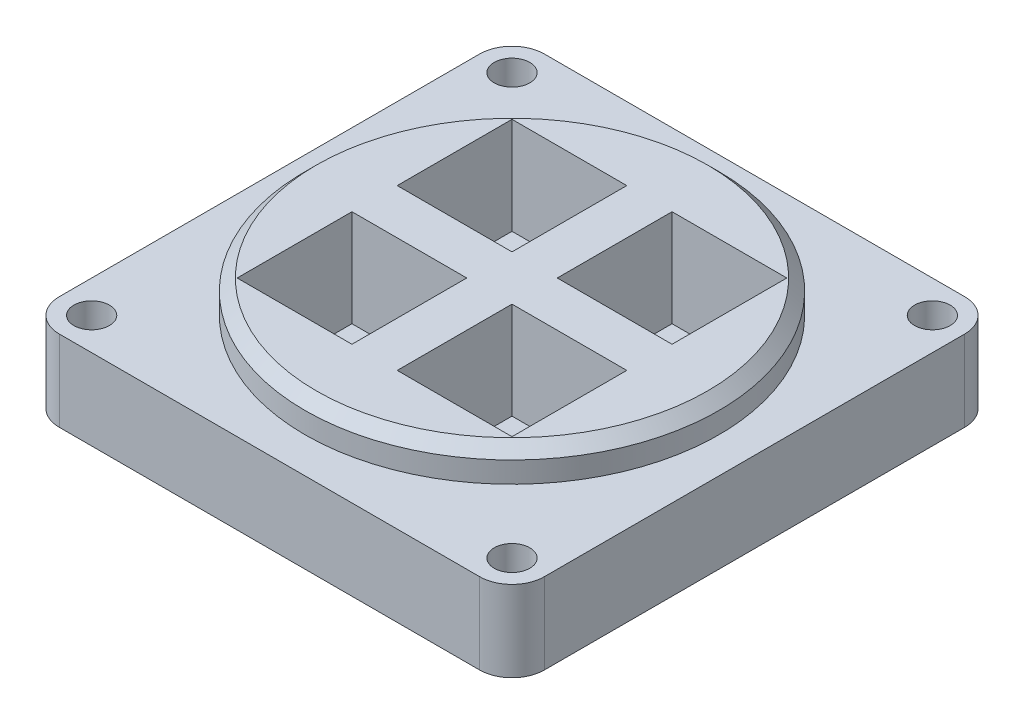
from build123d import *

# Parameters (mm, degrees)
SKETCH1_W           = 76.2
SKETCH1_H           = 76.2
BOSS_EXTRUDE1_DEPTH = 12.7
SKETCH2_R           = 2.794
CUT_EXTRUDE1_DEPTH  = 56.358016583
SKETCH2_3_R         = 32.512
BOSS_EXTRUDE2_DEPTH = 5.08
SKETCH5_W           = 18.034
SKETCH5_H           = 18.034
CUT_EXTRUDE2_DEPTH  = 15.24
FILLET1_R           = 5.08
CHAMFER1_SIZE       = 1.778


with BuildPart() as part:
    # Sketch1 → Boss-Extrude1 (new body)
    with BuildSketch(Plane(origin=(0, 0, 0), x_dir=(1, 0, 0), z_dir=(0, 1, 0))):
        Rectangle(SKETCH1_W, SKETCH1_H)
    extrude(amount=BOSS_EXTRUDE1_DEPTH)

    # Sketch2 → Cut-Extrude1 (cut, through all)
    with BuildSketch(Plane(origin=(0, 12.7, 0), x_dir=(1, 0, 0), z_dir=(0, 1, 0))):
        with Locations((33.02, 33.02)):
            Circle(SKETCH2_R)
        with Locations((33.02, -33.02)):
            Circle(SKETCH2_R)
        with Locations((-33.02, -33.02)):
            Circle(SKETCH2_R)
        with Locations((-33.02, 33.02)):
            Circle(SKETCH2_R)
    extrude(amount=-CUT_EXTRUDE1_DEPTH, mode=Mode.SUBTRACT)

    # Sketch2<3> → Boss-Extrude2 (add)
    with BuildSketch(Plane(origin=(0, 12.7, 0), x_dir=(1, 0, 0), z_dir=(0, 1, 0))):
        Circle(SKETCH2_3_R)
    extrude(amount=BOSS_EXTRUDE2_DEPTH)

    # Sketch5 → Cut-Extrude2 (cut)
    with BuildSketch(Plane(origin=(0, 17.78, 0), x_dir=(1, 0, 0), z_dir=(0, 1, 0))):
        with Locations((-12.572358569, 12.572358569)):
            Rectangle(SKETCH5_W, SKETCH5_H)
        with Locations((12.572358569, 12.572358569)):
            Rectangle(SKETCH5_W, SKETCH5_H)
        with Locations((12.572358569, -12.572358569)):
            Rectangle(SKETCH5_W, SKETCH5_H)
        with Locations((-12.572358569, -12.572358569)):
            Rectangle(SKETCH5_W, SKETCH5_H)
    extrude(amount=-CUT_EXTRUDE2_DEPTH, mode=Mode.SUBTRACT)

    # Fillet1
    fillet1_edges = [part.edges().sort_by_distance(p)[0] for p in [
        (-38.1, 6.35, 38.1),
        (38.1, 6.35, 38.1),
        (38.1, 6.35, -38.1),
        (-38.1, 6.35, -38.1),
    ]]
    fillet(fillet1_edges, radius=FILLET1_R)

    # Chamfer1
    chamfer1_edges = [part.edges().sort_by_distance(p)[0] for p in [
        (-32.512, 17.78, 0),
    ]]
    chamfer(chamfer1_edges, length=CHAMFER1_SIZE)


solid = part.part
